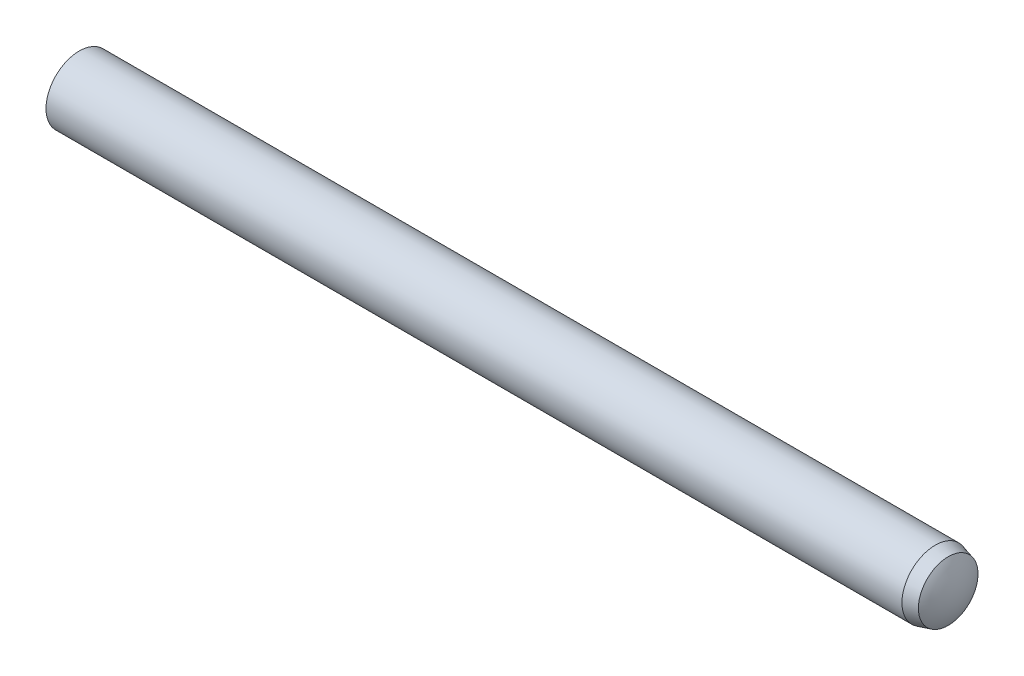
from build123d import *

# Parameters (mm, degrees)
EXTRUDE1_DEPTH      = 20
EXTRUDE1_DEPTH_BACK = 20
SKETCH2_R           = 1.5


with BuildPart() as part:
    # Sketch2 → Extrude1 (new, two sides: drawn at the far end of the back side and taken through both)
    with BuildSketch(Plane(origin=(0, 0, 0), x_dir=(0, 0, -1), z_dir=(1, 0, 0)).offset(-EXTRUDE1_DEPTH_BACK)):
        Circle(SKETCH2_R)
    extrude(amount=EXTRUDE1_DEPTH + EXTRUDE1_DEPTH_BACK)

    # Sketch5 → Cut-Revolve1 (revolve, cut)
    with BuildSketch(Plane.XY, mode=Mode.PRIVATE) as cut_revolve1_sk:
        with BuildLine():
            Line((19.025, 1.5), (19.025, 2))
            Line((19.025, 2), (20.5, 2))
            Line((20.5, 2), (20.5, 0))
            Line((20.5, 0), (20, 0))
            ThreePointArc((20, 0), (19.90052754, 0.699360389), (19.61, 1.343249722))
            Line((19.61, 1.343249722), (19.025, 1.5))
        make_face()
        with BuildLine():
            Line((-19.55, 1.5), (-19.55, 2))
            Line((-19.55, 2), (-20.5, 2))
            Line((-20.5, 2), (-20.5, 0))
            Line((-20.5, 0), (-20, 0))
            ThreePointArc((-20, 0), (-19.885076627, 0.783022988), (-19.55, 1.5))
        make_face()
    revolve(cut_revolve1_sk.sketch.rotate(Axis((-20, 0, 0), (1, 0, 0)), 90), axis=Axis((-20, 0, 0), (1, 0, 0)), mode=Mode.SUBTRACT)


solid = part.part
